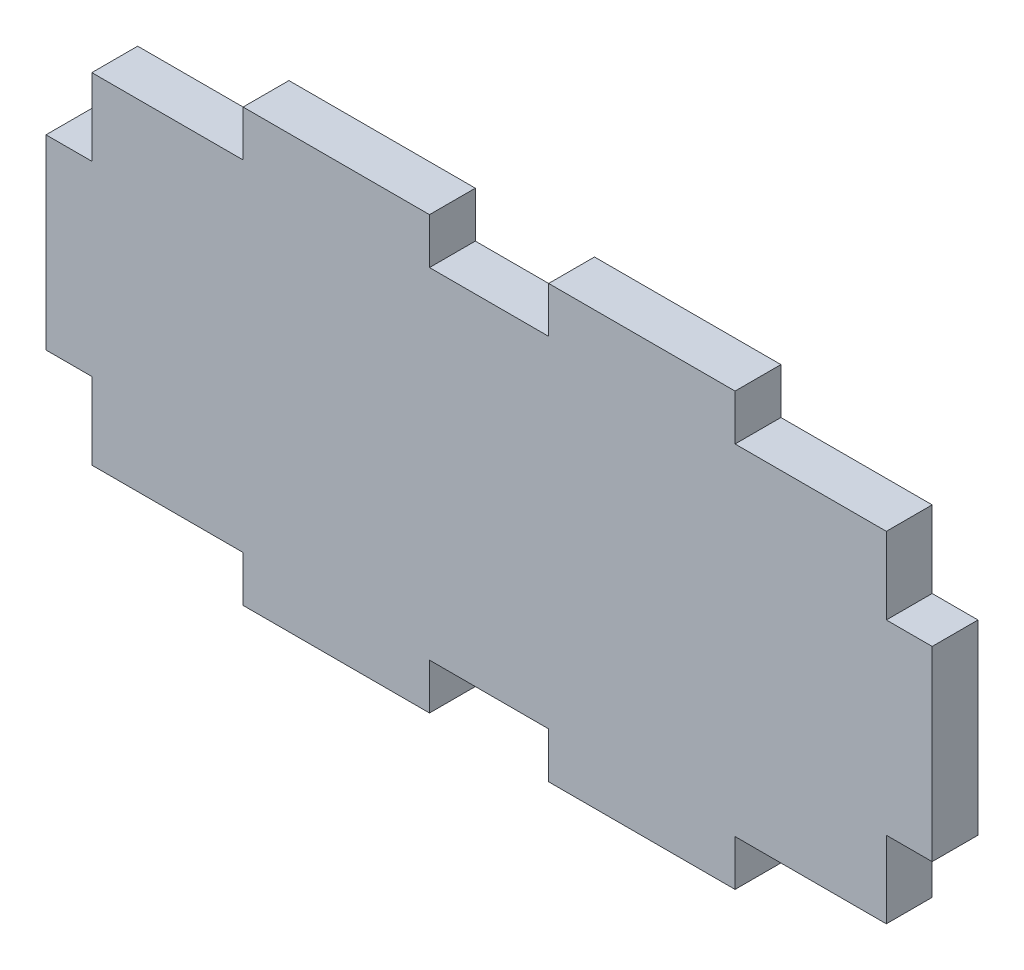
from build123d import *

# Parameters (mm, degrees)
BOSS_EXTRUDE1_DEPTH = 3


with BuildPart() as part:
    # Sketch2 → Boss-Extrude1 (new body)
    with BuildSketch(Plane.XY):
        Polygon((32.9, 0), (45.1, 0), (45.1, 3), (55, 3), (55, 8.025), (58, 8.025), (58, 20.225), (55, 20.225), (55, 25.25), (45.1, 25.25), (45.1, 28.25), (32.9, 28.25), (32.9, 25.25), (25.1, 25.25), (25.1, 28.25), (12.9, 28.25), (12.9, 25.25), (3, 25.25), (3, 20.225), (0, 20.225), (0, 8.025), (3, 8.025), (3, 3), (12.9, 3), (12.9, 0), (25.1, 0), (25.1, 3), (32.9, 3), align=None)
    extrude(amount=BOSS_EXTRUDE1_DEPTH)


solid = part.part
